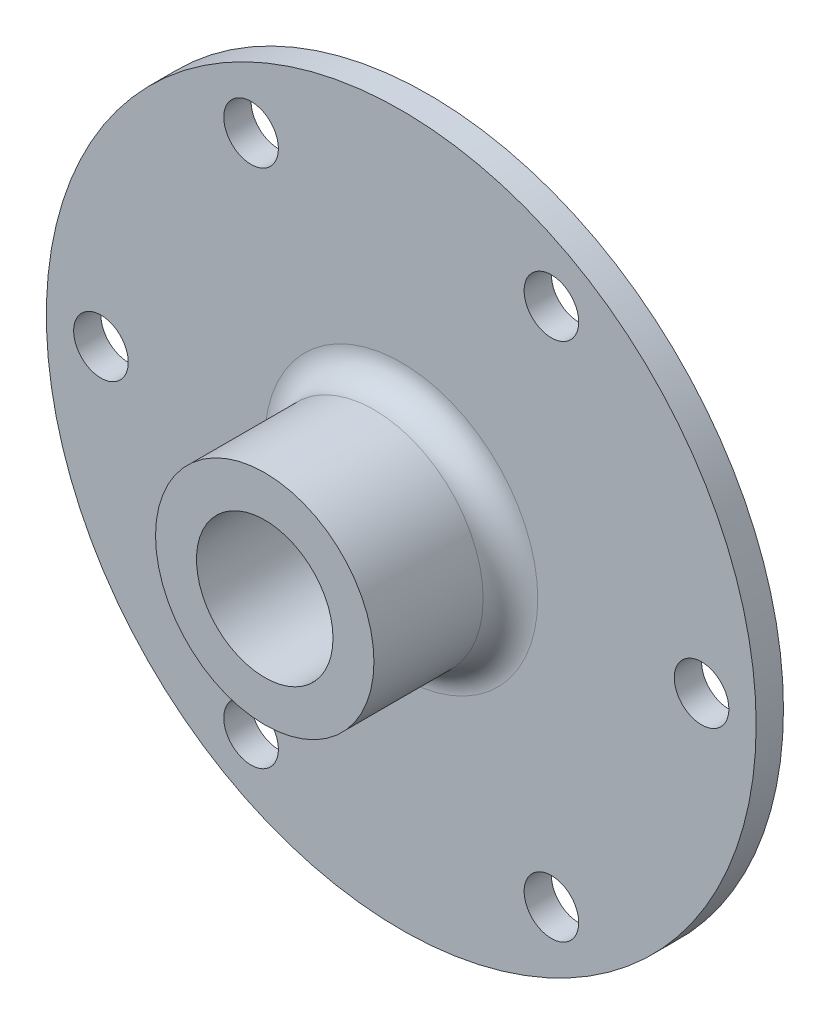
from build123d import *

# Parameters (mm, degrees)
SKETCH2_R          = 7.9375
CUT_EXTRUDE1_DEPTH = 62.401577748
SKETCH3_R          = 3.175
CUT_EXTRUDE2_DEPTH = 61.491874454
CIRPATTERN1_COUNT  = 6
FILLET1_R          = 3.175


with BuildPart() as part:
    # Sketch1 → Flange Base (revolve)
    with BuildSketch(Plane(origin=(0, 0, 0), x_dir=(0, 0, -1), z_dir=(1, 0, 0)), mode=Mode.PRIVATE) as flange_base_sk:
        Polygon((-19.05, 0), (0, 0), (0, 41.275), (-3.175, 41.275), (-3.175, 12.7), (-19.05, 12.7), align=None)
    revolve(flange_base_sk.sketch.rotate(Axis((0, 0, 19.05), (0, 0, -1)), 90), axis=Axis((0, 0, 19.05), (0, 0, -1)))

    # Sketch2 → Cut-Extrude1 (cut, through all)
    with BuildSketch(Plane.XY.offset(19.05)):
        Circle(SKETCH2_R)
    extrude(amount=-CUT_EXTRUDE1_DEPTH, mode=Mode.SUBTRACT)

    # Sketch3 → Cut-Extrude2 (cut, through all)
    with BuildSketch(Plane.XY.offset(3.175)):
        with Locations((34.925, 0)):
            Circle(SKETCH3_R)
    cut_extrude2 = extrude(amount=-CUT_EXTRUDE2_DEPTH, mode=Mode.SUBTRACT)

    # CirPattern1: Cut-Extrude2 ×6 about axis
    cirpattern1_axis = Axis((0, 0, 0), (0, 0, 1))
    for i in range(1, CIRPATTERN1_COUNT):
        add(cut_extrude2.rotate(cirpattern1_axis, i * 360 / CIRPATTERN1_COUNT), mode=Mode.SUBTRACT)

    # Fillet1
    fillet1_edges = [part.edges().sort_by_distance(p)[0] for p in [
        (-12.7, 0, 3.175),
    ]]
    fillet(fillet1_edges, radius=FILLET1_R)


solid = part.part
